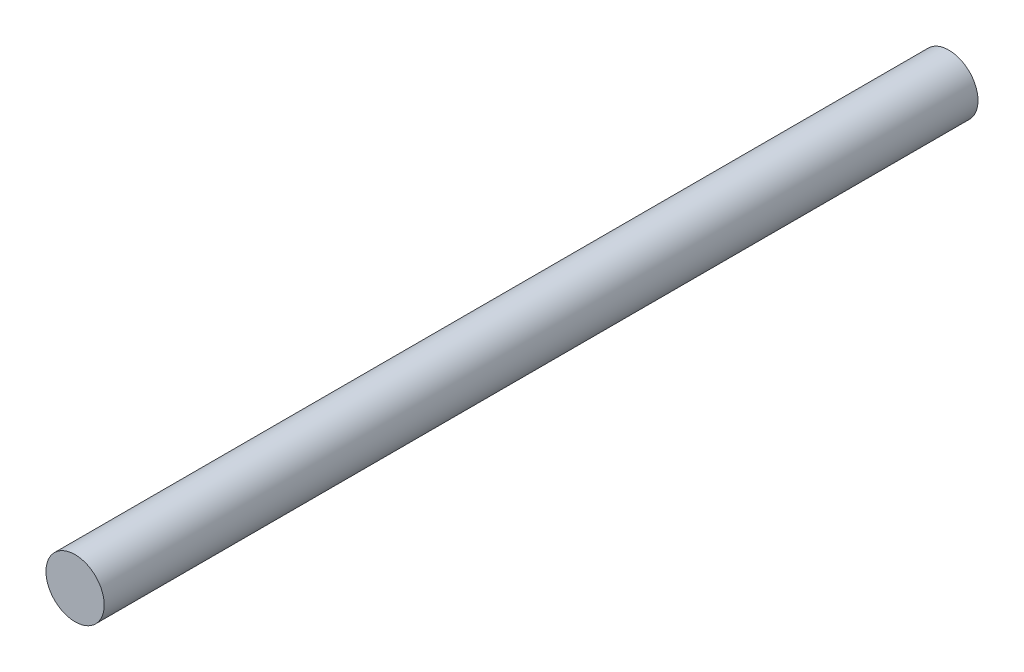
from build123d import *

# Parameters (mm, degrees)
SKETCH1_R           = 50
BOSS_EXTRUDE1_DEPTH = 1500


with BuildPart() as part:
    # Sketch1 → Boss-Extrude1 (new body)
    with BuildSketch(Plane.XY):
        Circle(SKETCH1_R)
    extrude(amount=BOSS_EXTRUDE1_DEPTH)


solid = part.part
